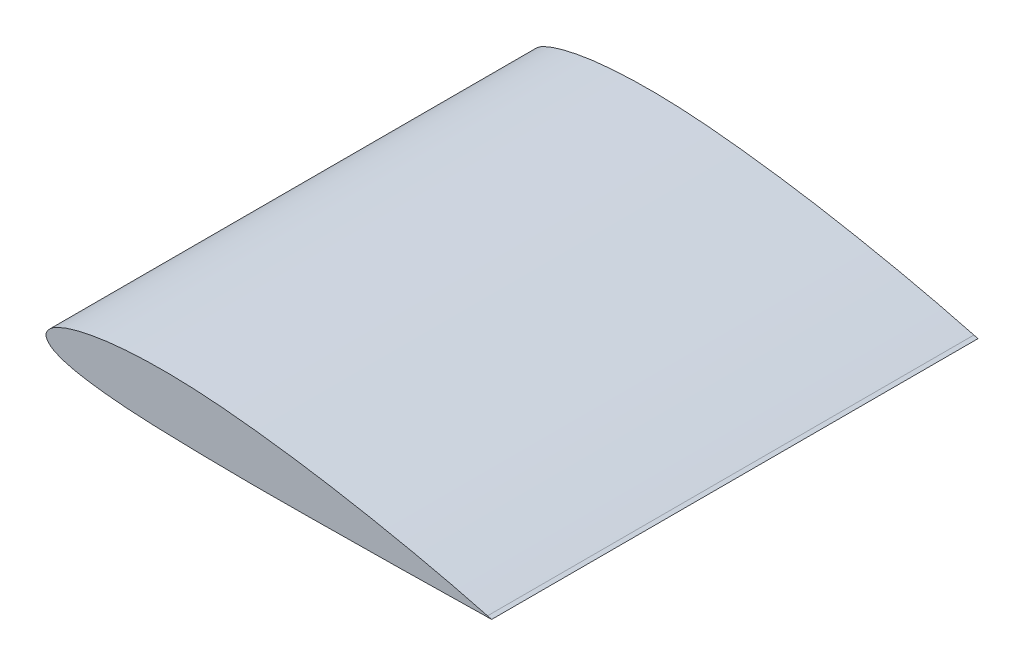
from build123d import *


with BuildPart() as part:
    # Sketch3 → Loft1 section 0
    with BuildSketch(Plane.XY):
        with BuildLine():
            Line((304.402760331, -9.206309447), (307.244987748, -9.943633681))
            Line((307.244987748, -9.943633681), (304.361804056, -9.997689479))
            add(Edge.make_bspline(
                [(304.402760331, -9.206309447), (299.386393305, -7.904974812), (289.366834348, -5.305723396), (269.292243905, -0.455697423), (244.157418673, 5.067813383), (213.93952694, 11.002079852), (183.689202989, 16.212376808), (153.375306279, 20.449953668), (123.023879434, 23.827993752), (97.63872708, 25.447666722), (77.294499113, 25.657862147), (61.992767442, 25.215004112), (46.634606061, 24.054498874), (33.812510772, 22.310235655), (23.548958486, 20.117280617), (15.746504066, 18.044448787), (9.09525196, 15.503022528), (3.305842356, 12.304112273), (-1.897531204, 6.523191652), (2.90852328, 0.956438003), (8.287253401, -1.747431977), (14.665860328, -3.919971957), (22.247032639, -5.633346115), (32.352306183, -7.28367259), (44.993986957, -8.805622753), (60.209207882, -9.940944481), (75.434015323, -10.680394184), (95.75087408, -11.282701477), (121.162053183, -11.789584979), (151.674243405, -11.96213272), (182.199368639, -11.713734618), (212.733374887, -11.393730006), (243.273783293, -11.050843591), (268.724480055, -10.596509904), (289.088670203, -10.284040099), (299.270526365, -10.093144055), (304.361804056, -9.997689479)],
                knots=[0, 0, 0, 0, 0.02501249, 0.049959286, 0.099672925, 0.14920632, 0.198581097, 0.24780517, 0.296916575, 0.345952722, 0.370491626, 0.395091204, 0.419814796, 0.444798575, 0.457489819, 0.470406405, 0.483879409, 0.49126412, 0.503458853, 0.513609129, 0.520450991, 0.533235388, 0.545691039, 0.558031884, 0.582609167, 0.607134742, 0.63165208, 0.656174272, 0.705233949, 0.754320379, 0.803437364, 0.852566096, 0.901700994, 0.950848809, 0.975422717, 1, 1, 1, 1], degree=3))
        make_face()
    # Sketch4 → Loft1 section 1
    with BuildSketch(Plane.XY.offset(335.28)):
        with BuildLine():
            Line((304.361804056, -9.997689479), (307.244987748, -9.943633681))
            Line((307.244987748, -9.943633681), (304.402760331, -9.206309447))
            add(Edge.make_bspline(
                [(304.402760331, -9.206309447), (299.386393305, -7.904974812), (289.366834348, -5.305723396), (269.292243905, -0.455697423), (244.157418673, 5.067813383), (213.93952694, 11.002079852), (183.689202989, 16.212376808), (153.375306279, 20.449953668), (123.023879434, 23.827993752), (97.63872708, 25.447666722), (77.294499113, 25.657862147), (61.992767442, 25.215004112), (46.634606061, 24.054498874), (33.812510772, 22.310235655), (23.548958486, 20.117280617), (15.746504066, 18.044448787), (9.09525196, 15.503022528), (3.305842356, 12.304112273), (-1.897531204, 6.523191652), (2.90852328, 0.956438003), (8.287253401, -1.747431977), (14.665860328, -3.919971957), (22.247032639, -5.633346115), (32.352306183, -7.28367259), (44.993986957, -8.805622753), (60.209207882, -9.940944481), (75.434015323, -10.680394184), (95.75087408, -11.282701477), (121.162053183, -11.789584979), (151.674243405, -11.96213272), (182.199368639, -11.713734618), (212.733374887, -11.393730006), (243.273783293, -11.050843591), (268.724480055, -10.596509904), (289.088670203, -10.284040099), (299.270526365, -10.093144055), (304.361804056, -9.997689479)],
                knots=[0, 0, 0, 0, 0.02501249, 0.049959286, 0.099672925, 0.14920632, 0.198581097, 0.24780517, 0.296916575, 0.345952722, 0.370491626, 0.395091204, 0.419814796, 0.444798575, 0.457489819, 0.470406405, 0.483879409, 0.49126412, 0.503458853, 0.513609129, 0.520450991, 0.533235388, 0.545691039, 0.558031884, 0.582609167, 0.607134742, 0.63165208, 0.656174272, 0.705233949, 0.754320379, 0.803437364, 0.852566096, 0.901700994, 0.950848809, 0.975422717, 1, 1, 1, 1], degree=3))
        make_face()
    loft()


solid = part.part
